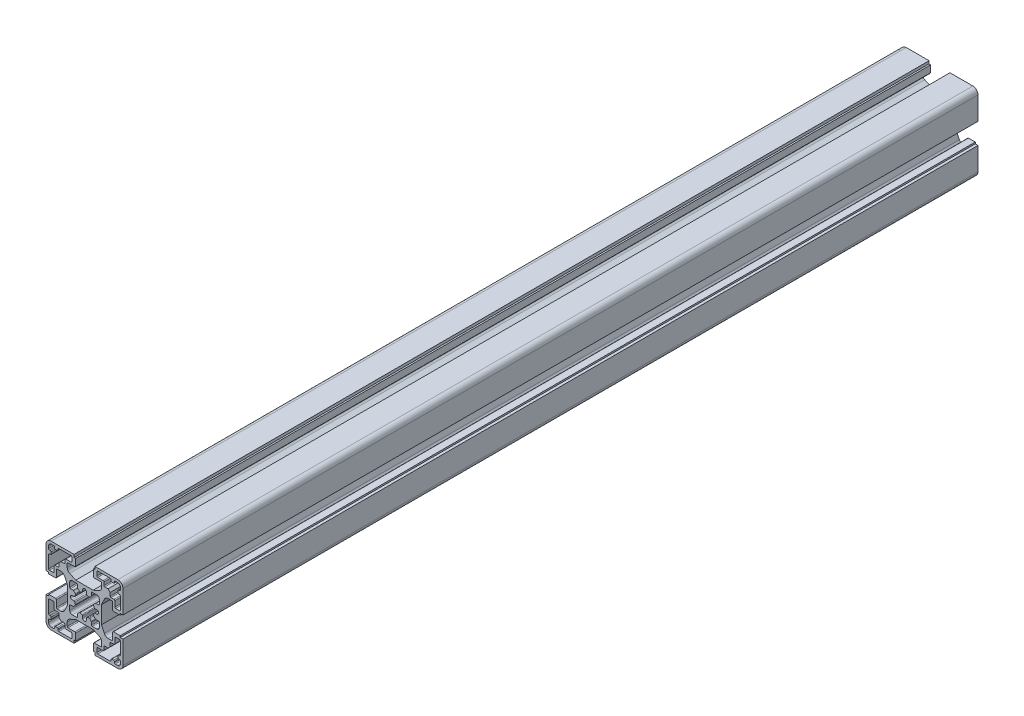
from build123d import *

# Parameters (mm, degrees)
SALIENTE_EXTRUIR1_DEPTH = 500


with BuildPart() as part:
    # Croquis1 → Saliente-Extruir1 (new body)
    with BuildSketch(Plane.XY.offset(1312.5)):
        with BuildLine():
            Line((-20.899999607, -6.099999885), (-22.5, -6.099999885))
            Line((-22.5, -6.099999885), (-22.5, -19.5))
            ThreePointArc((-22.5, -19.5), (-21.621320344, -21.621320344), (-19.5, -22.5))
            Line((-19.5, -22.5), (-6.099999885, -22.5))
            Line((-6.099999885, -22.5), (-6.099999885, -20.899999607))
            Line((-6.099999885, -20.899999607), (-5.174999903, -20.899999607))
            Line((-5.174999903, -20.899999607), (-5.174999903, -16.949999681))
            ThreePointArc((-5.174999903, -16.949999681), (-5.321446509, -16.596446297), (-5.674999893, -16.449999691))
            Line((-5.674999893, -16.449999691), (-9.59999982, -16.449999691))
            ThreePointArc((-9.59999982, -16.449999691), (-9.953553203, -16.303553084), (-10.09999981, -15.9499997))
            Line((-10.09999981, -15.9499997), (-10.09999981, -13.874213682))
            ThreePointArc((-10.09999981, -13.874213682), (-9.708478432, -12.530964686), (-8.656545492, -11.608444257))
            Line((-8.656545492, -11.608444257), (-5.099999904, -9.949999813))
            Line((-5.099999904, -9.949999813), (5.099999904, -9.949999813))
            Line((5.099999904, -9.949999813), (8.656545492, -11.608444257))
            ThreePointArc((8.656545492, -11.608444257), (9.708478432, -12.530964686), (10.09999981, -13.874213682))
            Line((10.09999981, -13.874213682), (10.09999981, -15.9499997))
            ThreePointArc((10.09999981, -15.9499997), (9.953553203, -16.303553084), (9.59999982, -16.449999691))
            Line((9.59999982, -16.449999691), (5.674999893, -16.449999691))
            ThreePointArc((5.674999893, -16.449999691), (5.321446509, -16.596446297), (5.174999903, -16.949999681))
            Line((5.174999903, -16.949999681), (5.174999903, -20.899999607))
            Line((5.174999903, -20.899999607), (6.099999885, -20.899999607))
            Line((6.099999885, -20.899999607), (6.099999885, -22.5))
            Line((6.099999885, -22.5), (19.5, -22.5))
            ThreePointArc((19.5, -22.5), (21.621320344, -21.621320344), (22.5, -19.5))
            Line((22.5, -19.5), (22.5, -6.099999885))
            Line((22.5, -6.099999885), (20.899999607, -6.099999885))
            Line((20.899999607, -6.099999885), (20.899999607, -5.174999903))
            Line((20.899999607, -5.174999903), (16.949999681, -5.174999903))
            ThreePointArc((16.949999681, -5.174999903), (16.596446297, -5.321446509), (16.449999691, -5.674999893))
            Line((16.449999691, -5.674999893), (16.449999691, -9.59999982))
            ThreePointArc((16.449999691, -9.59999982), (16.303553084, -9.953553203), (15.9499997, -10.09999981))
            Line((15.9499997, -10.09999981), (13.874213682, -10.09999981))
            ThreePointArc((13.874213682, -10.09999981), (12.530964686, -9.708478432), (11.608444257, -8.656545492))
            Line((11.608444257, -8.656545492), (9.949999813, -5.099999904))
            Line((9.949999813, -5.099999904), (9.949999813, 5.099999904))
            Line((9.949999813, 5.099999904), (11.608444257, 8.656545492))
            ThreePointArc((11.608444257, 8.656545492), (12.530964686, 9.708478432), (13.874213682, 10.09999981))
            Line((13.874213682, 10.09999981), (15.9499997, 10.09999981))
            ThreePointArc((15.9499997, 10.09999981), (16.303553084, 9.953553203), (16.449999691, 9.59999982))
            Line((16.449999691, 9.59999982), (16.449999691, 5.674999893))
            ThreePointArc((16.449999691, 5.674999893), (16.596446297, 5.321446509), (16.949999681, 5.174999903))
            Line((16.949999681, 5.174999903), (20.899999607, 5.174999903))
            Line((20.899999607, 5.174999903), (20.899999607, 6.099999885))
            Line((20.899999607, 6.099999885), (22.5, 6.099999885))
            Line((22.5, 6.099999885), (22.5, 19.5))
            ThreePointArc((22.5, 19.5), (21.621320344, 21.621320344), (19.5, 22.5))
            Line((19.5, 22.5), (6.099999885, 22.5))
            Line((6.099999885, 22.5), (6.099999885, 20.899999607))
            Line((6.099999885, 20.899999607), (5.174999903, 20.899999607))
            Line((5.174999903, 20.899999607), (5.174999903, 16.949999681))
            ThreePointArc((5.174999903, 16.949999681), (5.321446509, 16.596446297), (5.674999893, 16.449999691))
            Line((5.674999893, 16.449999691), (9.59999982, 16.449999691))
            ThreePointArc((9.59999982, 16.449999691), (9.953553203, 16.303553084), (10.09999981, 15.9499997))
            Line((10.09999981, 15.9499997), (10.09999981, 13.874213682))
            ThreePointArc((10.09999981, 13.874213682), (9.708478432, 12.530964686), (8.656545492, 11.608444257))
            Line((8.656545492, 11.608444257), (5.099999904, 9.949999813))
            Line((5.099999904, 9.949999813), (-5.099999904, 9.949999813))
            Line((-5.099999904, 9.949999813), (-8.656545492, 11.608444257))
            ThreePointArc((-8.656545492, 11.608444257), (-9.708478432, 12.530964686), (-10.09999981, 13.874213682))
            Line((-10.09999981, 13.874213682), (-10.09999981, 15.9499997))
            ThreePointArc((-10.09999981, 15.9499997), (-9.953553203, 16.303553084), (-9.59999982, 16.449999691))
            Line((-9.59999982, 16.449999691), (-5.674999893, 16.449999691))
            ThreePointArc((-5.674999893, 16.449999691), (-5.321446509, 16.596446297), (-5.174999903, 16.949999681))
            Line((-5.174999903, 16.949999681), (-5.174999903, 20.899999607))
            Line((-5.174999903, 20.899999607), (-6.099999885, 20.899999607))
            Line((-6.099999885, 20.899999607), (-6.099999885, 22.5))
            Line((-6.099999885, 22.5), (-19.5, 22.5))
            ThreePointArc((-19.5, 22.5), (-21.621320344, 21.621320344), (-22.5, 19.5))
            Line((-22.5, 19.5), (-22.5, 6.099999885))
            Line((-22.5, 6.099999885), (-20.899999607, 6.099999885))
            Line((-20.899999607, 6.099999885), (-20.899999607, 5.174999903))
            Line((-20.899999607, 5.174999903), (-16.949999681, 5.174999903))
            ThreePointArc((-16.949999681, 5.174999903), (-16.596446297, 5.321446509), (-16.449999691, 5.674999893))
            Line((-16.449999691, 5.674999893), (-16.449999691, 9.59999982))
            ThreePointArc((-16.449999691, 9.59999982), (-16.303553084, 9.953553203), (-15.9499997, 10.09999981))
            Line((-15.9499997, 10.09999981), (-13.874213682, 10.09999981))
            ThreePointArc((-13.874213682, 10.09999981), (-12.530964686, 9.708478432), (-11.608444257, 8.656545492))
            Line((-11.608444257, 8.656545492), (-9.949999813, 5.099999904))
            Line((-9.949999813, 5.099999904), (-9.949999813, -5.099999904))
            Line((-9.949999813, -5.099999904), (-11.608444257, -8.656545492))
            ThreePointArc((-11.608444257, -8.656545492), (-12.530964686, -9.708478432), (-13.874213682, -10.09999981))
            Line((-13.874213682, -10.09999981), (-15.9499997, -10.09999981))
            ThreePointArc((-15.9499997, -10.09999981), (-16.303553084, -9.953553203), (-16.449999691, -9.59999982))
            Line((-16.449999691, -9.59999982), (-16.449999691, -5.674999893))
            ThreePointArc((-16.449999691, -5.674999893), (-16.596446297, -5.321446509), (-16.949999681, -5.174999903))
            Line((-16.949999681, -5.174999903), (-20.899999607, -5.174999903))
            Line((-20.899999607, -5.174999903), (-20.899999607, -6.099999885))
        make_face()
        with BuildLine():
            Line((13.757359054, 14.999999718), (11.899999776, 14.999999718))
            ThreePointArc((11.899999776, 14.999999718), (11.546446392, 15.146446325), (11.399999786, 15.499999709))
            Line((11.399999786, 15.499999709), (11.399999786, 17.249999676))
            ThreePointArc((11.399999786, 17.249999676), (11.253553179, 17.60355306), (10.899999795, 17.749999666))
            Line((10.899999795, 17.749999666), (7.774999854, 17.749999666))
            ThreePointArc((7.774999854, 17.749999666), (7.42144647, 17.896446273), (7.274999863, 18.249999657))
            Line((7.274999863, 18.249999657), (7.274999863, 20.499999615))
            ThreePointArc((7.274999863, 20.499999615), (7.42144647, 20.853552999), (7.774999854, 20.999999605))
            Line((7.774999854, 20.999999605), (14.999999718, 20.999999605))
            ThreePointArc((14.999999718, 20.999999605), (15.353553102, 20.853552999), (15.499999709, 20.499999615))
            Line((15.499999709, 20.499999615), (15.499999709, 19.999999624))
            ThreePointArc((15.499999709, 19.999999624), (15.646446315, 19.64644624), (15.999999699, 19.499999633))
            Line((15.999999699, 19.499999633), (16.99999968, 19.499999633))
            ThreePointArc((16.99999968, 19.499999633), (17.353553064, 19.64644624), (17.499999671, 19.999999624))
            Line((17.499999671, 19.999999624), (17.499999671, 20.499999615))
            ThreePointArc((17.499999671, 20.499999615), (17.646446278, 20.853552999), (17.999999662, 20.999999605))
            Line((17.999999662, 20.999999605), (19.399999635, 20.999999605))
            ThreePointArc((19.399999635, 20.999999605), (20.531370464, 20.531370464), (20.999999605, 19.399999635))
            Line((20.999999605, 19.399999635), (20.999999605, 17.999999662))
            ThreePointArc((20.999999605, 17.999999662), (20.853552999, 17.646446278), (20.499999615, 17.499999671))
            Line((20.499999615, 17.499999671), (19.999999624, 17.499999671))
            ThreePointArc((19.999999624, 17.499999671), (19.64644624, 17.353553064), (19.499999633, 16.99999968))
            Line((19.499999633, 16.99999968), (19.499999633, 15.999999699))
            ThreePointArc((19.499999633, 15.999999699), (19.64644624, 15.646446315), (19.999999624, 15.499999709))
            Line((19.999999624, 15.499999709), (20.499999615, 15.499999709))
            ThreePointArc((20.499999615, 15.499999709), (20.853552999, 15.353553102), (20.999999605, 14.999999718))
            Line((20.999999605, 14.999999718), (20.999999605, 7.774999854))
            ThreePointArc((20.999999605, 7.774999854), (20.853552999, 7.42144647), (20.499999615, 7.274999863))
            Line((20.499999615, 7.274999863), (18.249999657, 7.274999863))
            ThreePointArc((18.249999657, 7.274999863), (17.896446273, 7.42144647), (17.749999666, 7.774999854))
            Line((17.749999666, 7.774999854), (17.749999666, 10.899999795))
            ThreePointArc((17.749999666, 10.899999795), (17.60355306, 11.253553179), (17.249999676, 11.399999786))
            Line((17.249999676, 11.399999786), (15.499999709, 11.399999786))
            ThreePointArc((15.499999709, 11.399999786), (15.146446325, 11.546446392), (14.999999718, 11.899999776))
            Line((14.999999718, 11.899999776), (14.999999718, 13.757359054))
            Line((14.999999718, 13.757359054), (13.757359054, 14.999999718))
        make_face(mode=Mode.SUBTRACT)
        with BuildLine():
            Line((-11.399999786, 17.249999676), (-11.399999786, 15.499999709))
            ThreePointArc((-11.399999786, 15.499999709), (-11.546446392, 15.146446325), (-11.899999776, 14.999999718))
            Line((-11.899999776, 14.999999718), (-13.757359054, 14.999999718))
            Line((-13.757359054, 14.999999718), (-14.999999718, 13.757359054))
            Line((-14.999999718, 13.757359054), (-14.999999718, 11.899999776))
            ThreePointArc((-14.999999718, 11.899999776), (-15.146446325, 11.546446392), (-15.499999709, 11.399999786))
            Line((-15.499999709, 11.399999786), (-17.249999676, 11.399999786))
            ThreePointArc((-17.249999676, 11.399999786), (-17.60355306, 11.253553179), (-17.749999666, 10.899999795))
            Line((-17.749999666, 10.899999795), (-17.749999666, 7.774999854))
            ThreePointArc((-17.749999666, 7.774999854), (-17.896446273, 7.42144647), (-18.249999657, 7.274999863))
            Line((-18.249999657, 7.274999863), (-20.499999615, 7.274999863))
            ThreePointArc((-20.499999615, 7.274999863), (-20.853552999, 7.42144647), (-20.999999605, 7.774999854))
            Line((-20.999999605, 7.774999854), (-20.999999605, 14.999999718))
            ThreePointArc((-20.999999605, 14.999999718), (-20.853552999, 15.353553102), (-20.499999615, 15.499999709))
            Line((-20.499999615, 15.499999709), (-19.999999624, 15.499999709))
            ThreePointArc((-19.999999624, 15.499999709), (-19.64644624, 15.646446315), (-19.499999633, 15.999999699))
            Line((-19.499999633, 15.999999699), (-19.499999633, 16.99999968))
            ThreePointArc((-19.499999633, 16.99999968), (-19.64644624, 17.353553064), (-19.999999624, 17.499999671))
            Line((-19.999999624, 17.499999671), (-20.499999615, 17.499999671))
            ThreePointArc((-20.499999615, 17.499999671), (-20.853552999, 17.646446278), (-20.999999605, 17.999999662))
            Line((-20.999999605, 17.999999662), (-20.999999605, 19.399999635))
            ThreePointArc((-20.999999605, 19.399999635), (-20.531370464, 20.531370464), (-19.399999635, 20.999999605))
            Line((-19.399999635, 20.999999605), (-17.999999662, 20.999999605))
            ThreePointArc((-17.999999662, 20.999999605), (-17.646446278, 20.853552999), (-17.499999671, 20.499999615))
            Line((-17.499999671, 20.499999615), (-17.499999671, 19.999999624))
            ThreePointArc((-17.499999671, 19.999999624), (-17.353553064, 19.64644624), (-16.99999968, 19.499999633))
            Line((-16.99999968, 19.499999633), (-15.999999699, 19.499999633))
            ThreePointArc((-15.999999699, 19.499999633), (-15.646446315, 19.64644624), (-15.499999709, 19.999999624))
            Line((-15.499999709, 19.999999624), (-15.499999709, 20.499999615))
            ThreePointArc((-15.499999709, 20.499999615), (-15.353553102, 20.853552999), (-14.999999718, 20.999999605))
            Line((-14.999999718, 20.999999605), (-7.774999854, 20.999999605))
            ThreePointArc((-7.774999854, 20.999999605), (-7.42144647, 20.853552999), (-7.274999863, 20.499999615))
            Line((-7.274999863, 20.499999615), (-7.274999863, 18.249999657))
            ThreePointArc((-7.274999863, 18.249999657), (-7.42144647, 17.896446273), (-7.774999854, 17.749999666))
            Line((-7.774999854, 17.749999666), (-10.899999795, 17.749999666))
            ThreePointArc((-10.899999795, 17.749999666), (-11.253553179, 17.60355306), (-11.399999786, 17.249999676))
        make_face(mode=Mode.SUBTRACT)
        with BuildLine():
            Line((-20.499999615, -7.274999863), (-18.249999657, -7.274999863))
            ThreePointArc((-18.249999657, -7.274999863), (-17.896446273, -7.42144647), (-17.749999666, -7.774999854))
            Line((-17.749999666, -7.774999854), (-17.749999666, -10.899999795))
            ThreePointArc((-17.749999666, -10.899999795), (-17.60355306, -11.253553179), (-17.249999676, -11.399999786))
            Line((-17.249999676, -11.399999786), (-15.499999709, -11.399999786))
            ThreePointArc((-15.499999709, -11.399999786), (-15.146446325, -11.546446392), (-14.999999718, -11.899999776))
            Line((-14.999999718, -11.899999776), (-14.999999718, -13.757359054))
            Line((-14.999999718, -13.757359054), (-13.757359054, -14.999999718))
            Line((-13.757359054, -14.999999718), (-11.899999776, -14.999999718))
            ThreePointArc((-11.899999776, -14.999999718), (-11.546446392, -15.146446325), (-11.399999786, -15.499999709))
            Line((-11.399999786, -15.499999709), (-11.399999786, -17.249999676))
            ThreePointArc((-11.399999786, -17.249999676), (-11.253553179, -17.60355306), (-10.899999795, -17.749999666))
            Line((-10.899999795, -17.749999666), (-7.774999854, -17.749999666))
            ThreePointArc((-7.774999854, -17.749999666), (-7.42144647, -17.896446273), (-7.274999863, -18.249999657))
            Line((-7.274999863, -18.249999657), (-7.274999863, -20.499999615))
            ThreePointArc((-7.274999863, -20.499999615), (-7.42144647, -20.853552999), (-7.774999854, -20.999999605))
            Line((-7.774999854, -20.999999605), (-14.999999718, -20.999999605))
            ThreePointArc((-14.999999718, -20.999999605), (-15.353553102, -20.853552999), (-15.499999709, -20.499999615))
            Line((-15.499999709, -20.499999615), (-15.499999709, -19.999999624))
            ThreePointArc((-15.499999709, -19.999999624), (-15.646446315, -19.64644624), (-15.999999699, -19.499999633))
            Line((-15.999999699, -19.499999633), (-16.99999968, -19.499999633))
            ThreePointArc((-16.99999968, -19.499999633), (-17.353553064, -19.64644624), (-17.499999671, -19.999999624))
            Line((-17.499999671, -19.999999624), (-17.499999671, -20.499999615))
            ThreePointArc((-17.499999671, -20.499999615), (-17.646446278, -20.853552999), (-17.999999662, -20.999999605))
            Line((-17.999999662, -20.999999605), (-19.399999635, -20.999999605))
            ThreePointArc((-19.399999635, -20.999999605), (-20.531370464, -20.531370464), (-20.999999605, -19.399999635))
            Line((-20.999999605, -19.399999635), (-20.999999605, -17.999999662))
            ThreePointArc((-20.999999605, -17.999999662), (-20.853552999, -17.646446278), (-20.499999615, -17.499999671))
            Line((-20.499999615, -17.499999671), (-19.999999624, -17.499999671))
            ThreePointArc((-19.999999624, -17.499999671), (-19.64644624, -17.353553064), (-19.499999633, -16.99999968))
            Line((-19.499999633, -16.99999968), (-19.499999633, -15.999999699))
            ThreePointArc((-19.499999633, -15.999999699), (-19.64644624, -15.646446315), (-19.999999624, -15.499999709))
            Line((-19.999999624, -15.499999709), (-20.499999615, -15.499999709))
            ThreePointArc((-20.499999615, -15.499999709), (-20.853552999, -15.353553102), (-20.999999605, -14.999999718))
            Line((-20.999999605, -14.999999718), (-20.999999605, -7.774999854))
            ThreePointArc((-20.999999605, -7.774999854), (-20.853552999, -7.42144647), (-20.499999615, -7.274999863))
        make_face(mode=Mode.SUBTRACT)
        with BuildLine():
            Line((-8.149999847, -4.099999923), (-6.711269711, -4.099999923))
            ThreePointArc((-6.711269711, -4.099999923), (-6.519927998, -4.06193969), (-6.357716327, -3.953553316))
            Line((-6.357716327, -3.953553316), (-5.414117751, -3.00995474))
            ThreePointArc((-5.414117751, -3.00995474), (-5.275473779, -2.744388592), (-5.313523801, -2.447235895))
            ThreePointArc((-5.313523801, -2.447235895), (-5.508921528, -1.968319668), (-5.661252191, -1.47401572))
            ThreePointArc((-5.661252191, -1.47401572), (-5.839335771, -1.204404144), (-6.1451199, -1.099999979))
            Line((-6.1451199, -1.099999979), (-7.149999866, -1.099999979))
            ThreePointArc((-7.149999866, -1.099999979), (-8.249999845, 0), (-7.149999866, 1.099999979))
            Line((-7.149999866, 1.099999979), (-6.1451199, 1.099999979))
            ThreePointArc((-6.1451199, 1.099999979), (-5.839335771, 1.204404144), (-5.661252191, 1.47401572))
            ThreePointArc((-5.661252191, 1.47401572), (-5.508921528, 1.968319668), (-5.313523801, 2.447235895))
            ThreePointArc((-5.313523801, 2.447235895), (-5.275473779, 2.744388592), (-5.414117751, 3.00995474))
            Line((-5.414117751, 3.00995474), (-6.357716327, 3.953553316))
            ThreePointArc((-6.357716327, 3.953553316), (-6.519927998, 4.06193969), (-6.711269711, 4.099999923))
            Line((-6.711269711, 4.099999923), (-8.149999847, 4.099999923))
            ThreePointArc((-8.149999847, 4.099999923), (-8.503553231, 4.24644653), (-8.649999837, 4.599999914))
            Line((-8.649999837, 4.599999914), (-8.649999837, 7.149999866))
            ThreePointArc((-8.649999837, 7.149999866), (-8.210660017, 8.210660017), (-7.149999866, 8.649999837))
            Line((-7.149999866, 8.649999837), (-4.599999914, 8.649999837))
            ThreePointArc((-4.599999914, 8.649999837), (-4.24644653, 8.503553231), (-4.099999923, 8.149999847))
            Line((-4.099999923, 8.149999847), (-4.099999923, 6.711269711))
            ThreePointArc((-4.099999923, 6.711269711), (-4.06193969, 6.519927998), (-3.953553316, 6.357716327))
            Line((-3.953553316, 6.357716327), (-3.00995474, 5.414117751))
            ThreePointArc((-3.00995474, 5.414117751), (-2.744388592, 5.275473779), (-2.447235895, 5.313523801))
            ThreePointArc((-2.447235895, 5.313523801), (-1.968319668, 5.508921528), (-1.47401572, 5.661252191))
            ThreePointArc((-1.47401572, 5.661252191), (-1.204404144, 5.839335771), (-1.099999979, 6.1451199))
            Line((-1.099999979, 6.1451199), (-1.099999979, 7.149999866))
            ThreePointArc((-1.099999979, 7.149999866), (0, 8.249999845), (1.099999979, 7.149999866))
            Line((1.099999979, 7.149999866), (1.099999979, 6.1451199))
            ThreePointArc((1.099999979, 6.1451199), (1.204404144, 5.839335771), (1.47401572, 5.661252191))
            ThreePointArc((1.47401572, 5.661252191), (1.968319668, 5.508921528), (2.447235895, 5.313523801))
            ThreePointArc((2.447235895, 5.313523801), (2.744388592, 5.275473779), (3.00995474, 5.414117751))
            Line((3.00995474, 5.414117751), (3.953553316, 6.357716327))
            ThreePointArc((3.953553316, 6.357716327), (4.06193969, 6.519927998), (4.099999923, 6.711269711))
            Line((4.099999923, 6.711269711), (4.099999923, 8.149999847))
            ThreePointArc((4.099999923, 8.149999847), (4.24644653, 8.503553231), (4.599999914, 8.649999837))
            Line((4.599999914, 8.649999837), (7.149999866, 8.649999837))
            ThreePointArc((7.149999866, 8.649999837), (8.210660017, 8.210660017), (8.649999837, 7.149999866))
            Line((8.649999837, 7.149999866), (8.649999837, 4.599999914))
            ThreePointArc((8.649999837, 4.599999914), (8.503553231, 4.24644653), (8.149999847, 4.099999923))
            Line((8.149999847, 4.099999923), (6.711269711, 4.099999923))
            ThreePointArc((6.711269711, 4.099999923), (6.519927998, 4.06193969), (6.357716327, 3.953553316))
            Line((6.357716327, 3.953553316), (5.414117751, 3.00995474))
            ThreePointArc((5.414117751, 3.00995474), (5.275473779, 2.744388592), (5.313523801, 2.447235895))
            ThreePointArc((5.313523801, 2.447235895), (5.508921528, 1.968319668), (5.661252191, 1.47401572))
            ThreePointArc((5.661252191, 1.47401572), (5.839335771, 1.204404144), (6.1451199, 1.099999979))
            Line((6.1451199, 1.099999979), (7.149999866, 1.099999979))
            ThreePointArc((7.149999866, 1.099999979), (8.249999845, 0), (7.149999866, -1.099999979))
            Line((7.149999866, -1.099999979), (6.1451199, -1.099999979))
            ThreePointArc((6.1451199, -1.099999979), (5.839335771, -1.204404144), (5.661252191, -1.47401572))
            ThreePointArc((5.661252191, -1.47401572), (5.508921528, -1.968319668), (5.313523801, -2.447235895))
            ThreePointArc((5.313523801, -2.447235895), (5.275473779, -2.744388592), (5.414117751, -3.00995474))
            Line((5.414117751, -3.00995474), (6.357716327, -3.953553316))
            ThreePointArc((6.357716327, -3.953553316), (6.519927998, -4.06193969), (6.711269711, -4.099999923))
            Line((6.711269711, -4.099999923), (8.149999847, -4.099999923))
            ThreePointArc((8.149999847, -4.099999923), (8.503553231, -4.24644653), (8.649999837, -4.599999914))
            Line((8.649999837, -4.599999914), (8.649999837, -7.149999866))
            ThreePointArc((8.649999837, -7.149999866), (8.210660017, -8.210660017), (7.149999866, -8.649999837))
            Line((7.149999866, -8.649999837), (4.599999914, -8.649999837))
            ThreePointArc((4.599999914, -8.649999837), (4.24644653, -8.503553231), (4.099999923, -8.149999847))
            Line((4.099999923, -8.149999847), (4.099999923, -6.711269711))
            ThreePointArc((4.099999923, -6.711269711), (4.06193969, -6.519927998), (3.953553316, -6.357716327))
            Line((3.953553316, -6.357716327), (3.00995474, -5.414117751))
            ThreePointArc((3.00995474, -5.414117751), (2.744388592, -5.275473779), (2.447235895, -5.313523801))
            ThreePointArc((2.447235895, -5.313523801), (1.968319668, -5.508921528), (1.47401572, -5.661252191))
            ThreePointArc((1.47401572, -5.661252191), (1.204404144, -5.839335771), (1.099999979, -6.1451199))
            Line((1.099999979, -6.1451199), (1.099999979, -7.149999866))
            ThreePointArc((1.099999979, -7.149999866), (0, -8.249999845), (-1.099999979, -7.149999866))
            Line((-1.099999979, -7.149999866), (-1.099999979, -6.1451199))
            ThreePointArc((-1.099999979, -6.1451199), (-1.204404144, -5.839335771), (-1.47401572, -5.661252191))
            ThreePointArc((-1.47401572, -5.661252191), (-1.968319668, -5.508921528), (-2.447235895, -5.313523801))
            ThreePointArc((-2.447235895, -5.313523801), (-2.744388592, -5.275473779), (-3.00995474, -5.414117751))
            Line((-3.00995474, -5.414117751), (-3.953553316, -6.357716327))
            ThreePointArc((-3.953553316, -6.357716327), (-4.06193969, -6.519927998), (-4.099999923, -6.711269711))
            Line((-4.099999923, -6.711269711), (-4.099999923, -8.149999847))
            ThreePointArc((-4.099999923, -8.149999847), (-4.24644653, -8.503553231), (-4.599999914, -8.649999837))
            Line((-4.599999914, -8.649999837), (-7.149999866, -8.649999837))
            ThreePointArc((-7.149999866, -8.649999837), (-8.210660017, -8.210660017), (-8.649999837, -7.149999866))
            Line((-8.649999837, -7.149999866), (-8.649999837, -4.599999914))
            ThreePointArc((-8.649999837, -4.599999914), (-8.503553231, -4.24644653), (-8.149999847, -4.099999923))
        make_face(mode=Mode.SUBTRACT)
        with BuildLine():
            Line((11.899999776, -14.999999718), (13.757359054, -14.999999718))
            Line((13.757359054, -14.999999718), (14.999999718, -13.757359054))
            Line((14.999999718, -13.757359054), (14.999999718, -11.899999776))
            ThreePointArc((14.999999718, -11.899999776), (15.146446325, -11.546446392), (15.499999709, -11.399999786))
            Line((15.499999709, -11.399999786), (17.249999676, -11.399999786))
            ThreePointArc((17.249999676, -11.399999786), (17.60355306, -11.253553179), (17.749999666, -10.899999795))
            Line((17.749999666, -10.899999795), (17.749999666, -7.774999854))
            ThreePointArc((17.749999666, -7.774999854), (17.896446273, -7.42144647), (18.249999657, -7.274999863))
            Line((18.249999657, -7.274999863), (20.499999615, -7.274999863))
            ThreePointArc((20.499999615, -7.274999863), (20.853552999, -7.42144647), (20.999999605, -7.774999854))
            Line((20.999999605, -7.774999854), (20.999999605, -14.999999718))
            ThreePointArc((20.999999605, -14.999999718), (20.853552999, -15.353553102), (20.499999615, -15.499999709))
            Line((20.499999615, -15.499999709), (19.999999624, -15.499999709))
            ThreePointArc((19.999999624, -15.499999709), (19.64644624, -15.646446315), (19.499999633, -15.999999699))
            Line((19.499999633, -15.999999699), (19.499999633, -16.99999968))
            ThreePointArc((19.499999633, -16.99999968), (19.64644624, -17.353553064), (19.999999624, -17.499999671))
            Line((19.999999624, -17.499999671), (20.499999615, -17.499999671))
            ThreePointArc((20.499999615, -17.499999671), (20.853552999, -17.646446278), (20.999999605, -17.999999662))
            Line((20.999999605, -17.999999662), (20.999999605, -19.399999635))
            ThreePointArc((20.999999605, -19.399999635), (20.531370464, -20.531370464), (19.399999635, -20.999999605))
            Line((19.399999635, -20.999999605), (17.999999662, -20.999999605))
            ThreePointArc((17.999999662, -20.999999605), (17.646446278, -20.853552999), (17.499999671, -20.499999615))
            Line((17.499999671, -20.499999615), (17.499999671, -19.999999624))
            ThreePointArc((17.499999671, -19.999999624), (17.353553064, -19.64644624), (16.99999968, -19.499999633))
            Line((16.99999968, -19.499999633), (15.999999699, -19.499999633))
            ThreePointArc((15.999999699, -19.499999633), (15.646446315, -19.64644624), (15.499999709, -19.999999624))
            Line((15.499999709, -19.999999624), (15.499999709, -20.499999615))
            ThreePointArc((15.499999709, -20.499999615), (15.353553102, -20.853552999), (14.999999718, -20.999999605))
            Line((14.999999718, -20.999999605), (7.774999854, -20.999999605))
            ThreePointArc((7.774999854, -20.999999605), (7.42144647, -20.853552999), (7.274999863, -20.499999615))
            Line((7.274999863, -20.499999615), (7.274999863, -18.249999657))
            ThreePointArc((7.274999863, -18.249999657), (7.42144647, -17.896446273), (7.774999854, -17.749999666))
            Line((7.774999854, -17.749999666), (10.899999795, -17.749999666))
            ThreePointArc((10.899999795, -17.749999666), (11.253553179, -17.60355306), (11.399999786, -17.249999676))
            Line((11.399999786, -17.249999676), (11.399999786, -15.499999709))
            ThreePointArc((11.399999786, -15.499999709), (11.546446392, -15.146446325), (11.899999776, -14.999999718))
        make_face(mode=Mode.SUBTRACT)
    extrude(amount=-SALIENTE_EXTRUIR1_DEPTH)


solid = part.part
